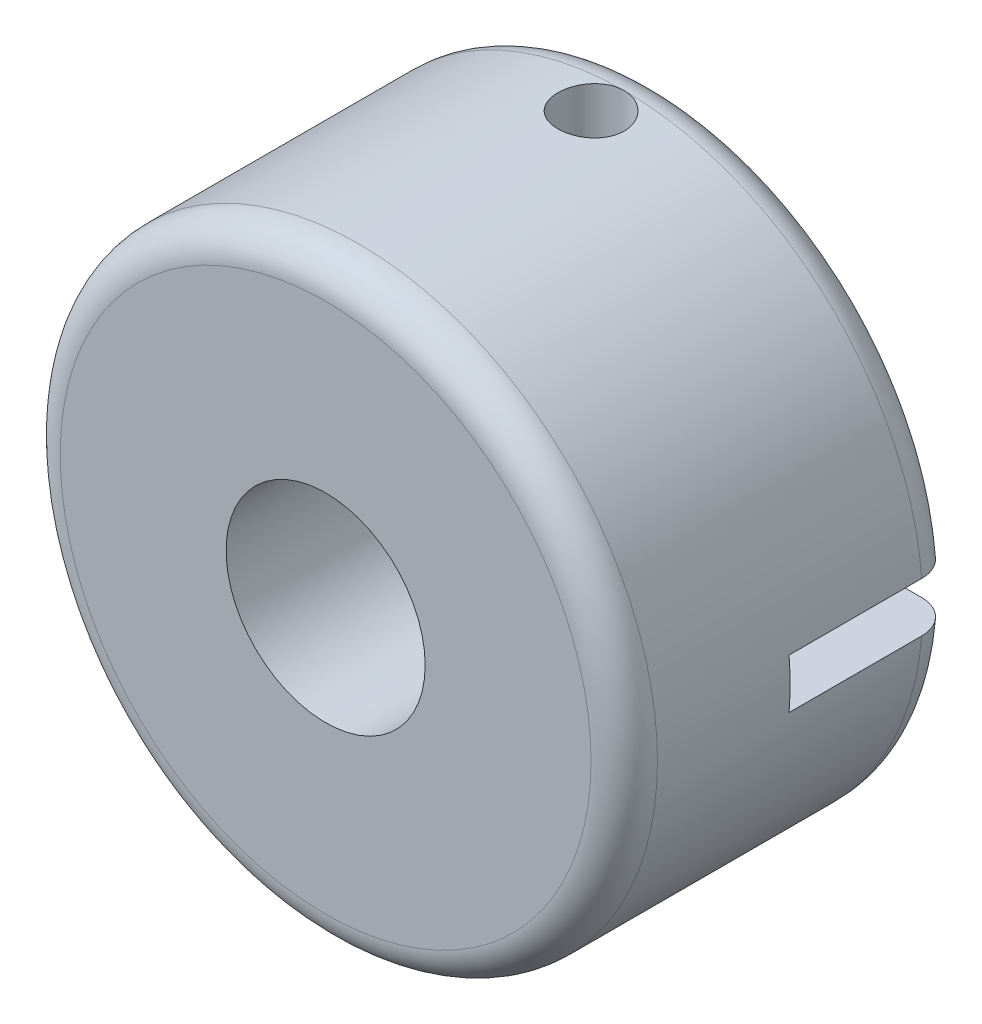
from build123d import *

# Parameters (mm, degrees)
SKETCH_1_R               = 9
EXTRUDE_1_DEPTH          = 10
CUT_EXTRUDE_1_DEPTH      = 17.186414056
CUT_EXTRUDE_1_DEPTH_BACK = 17.186414056
SKETCH_2_W               = 10
SKETCH_2_H               = 1.5
CUT_EXTRUDE_2_DEPTH      = 17.186414056
CUT_EXTRUDE_2_DEPTH_BACK = 17.186414056
SKETCH_3_R               = 1
FILLET_1_R               = 1
SKETCH_4_R               = 3
CUT_EXTRUDE_3_DEPTH      = 6


with BuildPart() as part:
    # 草图1 → 凸台-拉伸1 (new body)
    with BuildSketch(Plane.XY):
        Circle(SKETCH_1_R)
    extrude(amount=EXTRUDE_1_DEPTH)

    # 草图2 → 切除-拉伸1 (cut, two sides: drawn at the far end of the back side and taken through both)
    with BuildSketch(Plane(origin=(0, 0, 0), x_dir=(0, 0, -1), z_dir=(1, 0, 0)).offset(-CUT_EXTRUDE_1_DEPTH_BACK)):
        Rectangle(SKETCH_2_W, SKETCH_2_H)
    extrude(amount=CUT_EXTRUDE_1_DEPTH + CUT_EXTRUDE_1_DEPTH_BACK, mode=Mode.SUBTRACT)

    # 草图3 → 切除-拉伸2 (cut, two sides: drawn at the far end of the back side and taken through both)
    with BuildSketch(Plane(origin=(0, 0, 0), x_dir=(1, 0, 0), z_dir=(0, 1, 0)).offset(-CUT_EXTRUDE_2_DEPTH_BACK)):
        with Locations(Location((0, -2, 0), (0, 0, 270))):
            Circle(SKETCH_3_R)
    extrude(amount=CUT_EXTRUDE_2_DEPTH + CUT_EXTRUDE_2_DEPTH_BACK, mode=Mode.SUBTRACT)

    # 圆角1
    fillet_1_edges = [part.edges().sort_by_distance(p)[0] for p in [
        (-9, 0, 10),
        (0, 9, 0),
        (0, -9, 0),
    ]]
    fillet(fillet_1_edges, radius=FILLET_1_R)

    # 草图4 → 切除-拉伸3 (cut)
    with BuildSketch(Plane.XY.offset(10)):
        Circle(SKETCH_4_R)
    extrude(amount=-CUT_EXTRUDE_3_DEPTH, mode=Mode.SUBTRACT)


solid = part.part
